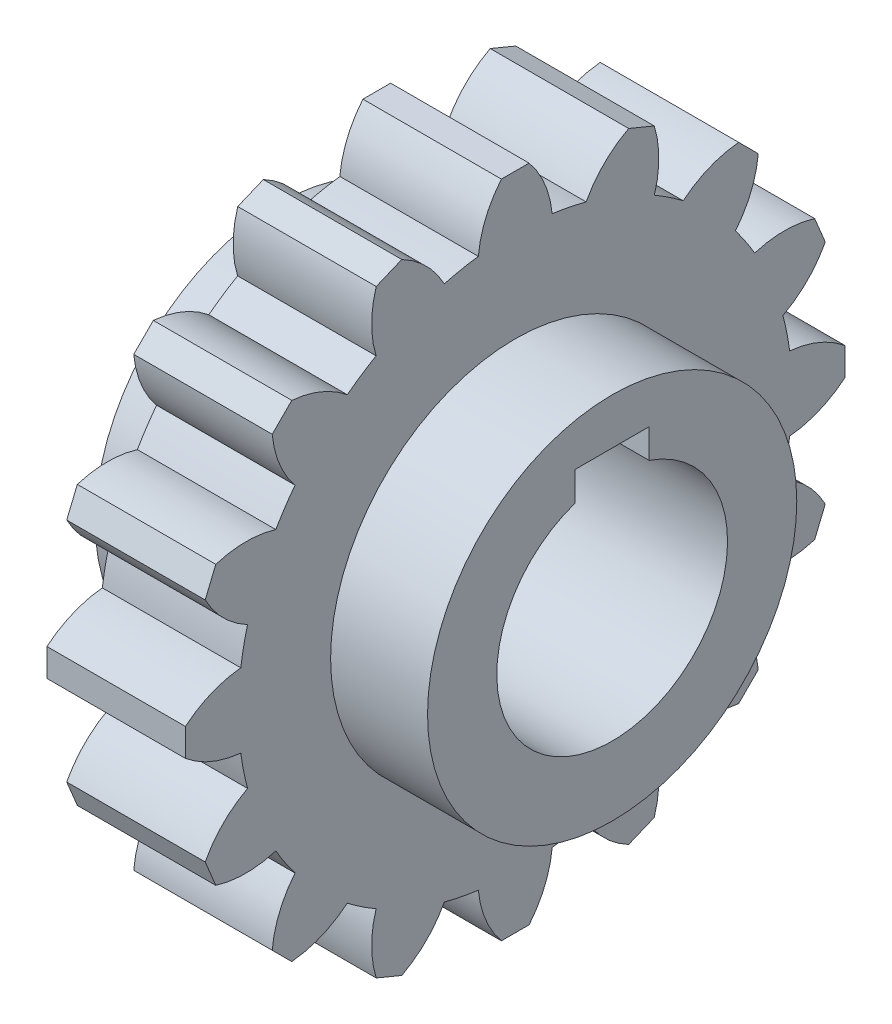
from build123d import *

# Parameters (mm, degrees)
SKETCH1_R           = 30
BOSS_EXTRUDE1_DEPTH = 7.5
BOSS_EXTRUDE2_DEPTH = 15
CIRPATTERN1_COUNT   = 16
SKETCH3_R           = 20
BOSS_EXTRUDE3_DEPTH = 18
CUT_EXTRUDE1_DEPTH  = 63.04491357


with BuildPart() as part:
    # Sketch1 → Boss-Extrude1 (new, symmetric)
    with BuildSketch(Plane(origin=(0, 0, 0), x_dir=(0, 0, -1), z_dir=(1, 0, 0))):
        Circle(SKETCH1_R)
    extrude(amount=BOSS_EXTRUDE1_DEPTH, both=True)

    # Sketch2 → Boss-Extrude2 (add)
    with BuildSketch(Plane(origin=(7.5, 0, 0), x_dir=(0, 0, -1), z_dir=(1, 0, 0))):
        with BuildLine():
            Line((1.5, 35.732137495), (-1.5, 35.732137495))
            ThreePointArc((-1.5, 35.732137495), (-3.203300204, 32.92101258), (-4, 29.732137495))
            ThreePointArc((-4, 29.732137495), (0, 30), (4, 29.732137495))
            ThreePointArc((4, 29.732137495), (3.203300204, 32.92101258), (1.5, 35.732137495))
        make_face()
    boss_extrude2 = extrude(amount=-BOSS_EXTRUDE2_DEPTH)

    # CirPattern1: Boss-Extrude2 ×16 about axis
    cirpattern1_axis = Axis((0, 0, 0), (1, 0, 0))
    for i in range(1, CIRPATTERN1_COUNT):
        add(boss_extrude2.rotate(cirpattern1_axis, i * 360 / CIRPATTERN1_COUNT))

    # Sketch3 → Boss-Extrude3 (add, symmetric)
    with BuildSketch(Plane(origin=(0, 0, 0), x_dir=(0, 0, -1), z_dir=(1, 0, 0))):
        Circle(SKETCH3_R)
    extrude(amount=BOSS_EXTRUDE3_DEPTH, both=True)

    # Sketch4 → Cut-Extrude1 (cut, through all)
    with BuildSketch(Plane(origin=(18, 0, 0), x_dir=(0, 0, -1), z_dir=(1, 0, 0))):
        with BuildLine():
            Line((-4, 15), (4, 15))
            Line((4, 15), (4, 11.842719282))
            ThreePointArc((4, 11.842719282), (0, -12.5), (-4, 11.842719282))
            Line((-4, 11.842719282), (-4, 15))
        make_face()
    extrude(amount=-CUT_EXTRUDE1_DEPTH, mode=Mode.SUBTRACT)


solid = part.part
